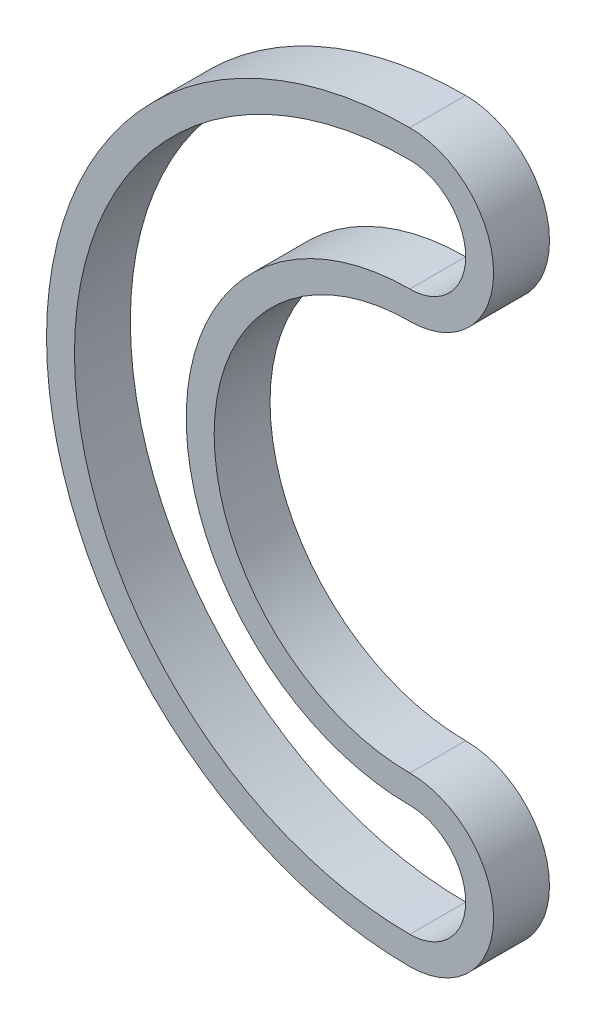
from build123d import *

# Parameters (mm, degrees)
EXTRUDE_1_DEPTH = 0.5


with BuildPart() as part:
    # 草图1 → 凸台-拉伸1 (new, symmetric)
    with BuildSketch(Plane.XY):
        with BuildLine():
            ThreePointArc((-0.975265745, 11.076672173), (-4.475265745, 7.576672173), (-0.975265745, 4.076672173))
            ThreePointArc((-0.975265745, 4.076672173), (0.524734255, 2.576672173), (-0.975265745, 1.076672173))
            ThreePointArc((-0.975265745, 1.076672173), (-7.475265745, 7.576672173), (-0.975265745, 14.076672173))
            ThreePointArc((-0.975265745, 14.076672173), (0.524734255, 12.576672173), (-0.975265745, 11.076672173))
        make_face()
        with BuildLine():
            ThreePointArc((-0.975265745, 11.576672173), (-4.975265745, 7.576672173), (-0.975265745, 3.576672173))
            ThreePointArc((-0.975265745, 3.576672173), (0.024734255, 2.576672173), (-0.975265745, 1.576672173))
            ThreePointArc((-0.975265745, 1.576672173), (-6.975265745, 7.576672173), (-0.975265745, 13.576672173))
            ThreePointArc((-0.975265745, 13.576672173), (0.024734255, 12.576672173), (-0.975265745, 11.576672173))
        make_face(mode=Mode.SUBTRACT)
    extrude(amount=EXTRUDE_1_DEPTH, both=True)


solid = part.part
